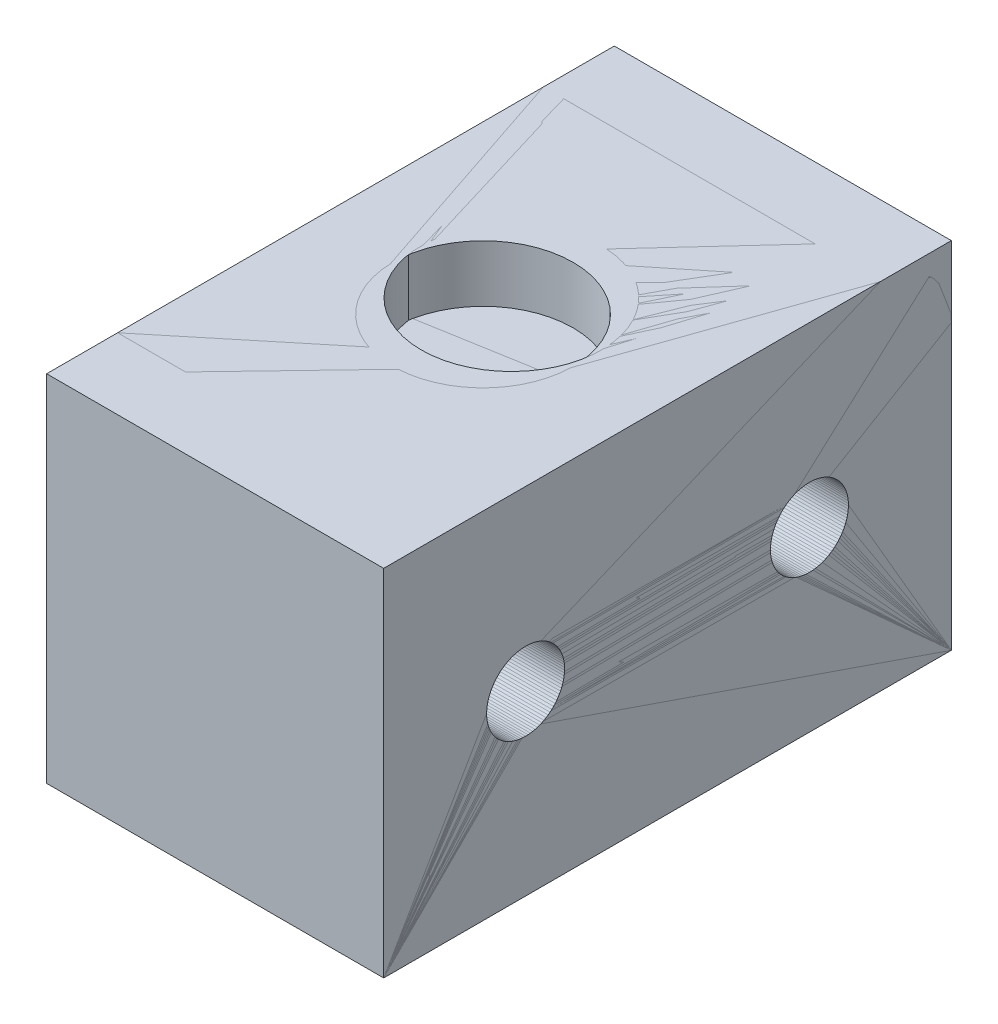
from build123d import *

# Parameters (mm, degrees)
ESQUISSE2_W             = 23.75
ESQUISSE2_H             = 25
BOSS_EXTRU_1_DEPTH      = 40
ESQUISSE3_R             = 6.35
ENL_V_MAT_EXTRU_1_DEPTH = 4
D_GAGEMENT_M51_D        = 5.5
CONG_1_R                = 5


with BuildPart() as part:
    # Esquisse2 → Boss.-Extru.1 (new body)
    with BuildSketch(Plane.XY):
        with Locations((-11.875, 87.5)):
            Rectangle(ESQUISSE2_W, ESQUISSE2_H)
    extrude(amount=-BOSS_EXTRU_1_DEPTH)

    # Esquisse3 → Enlèv. mat.-Extru.1 (cut)
    with BuildSketch(Plane(origin=(0, 100, 0), x_dir=(1, 0, 0), z_dir=(0, 1, 0))):
        with Locations(Location((-12, 21, 0), (0, 0, 270))):
            Circle(ESQUISSE3_R)
    extrude(amount=-ENL_V_MAT_EXTRU_1_DEPTH, mode=Mode.SUBTRACT)

    # Dégagement M51 (through all)
    with Locations(Plane(origin=(0, 87.5, -10), x_dir=(0, 1, 0), z_dir=(1, 0, 0))):
        with Locations((0, 0), (0, -20)):
            Hole(D_GAGEMENT_M51_D / 2)

    # Congé1
    cong_1_edges = [part.edges().sort_by_distance(p)[0] for p in [
        (-11.875, 100, 0),
    ]]
    fillet(cong_1_edges, radius=CONG_1_R)


with BuildPart() as body_2:
    # Symétrie1: mirrored copy
    add(part.part.mirror(Plane.XY.offset(-20)))


solid = Compound([part.part, body_2.part])
